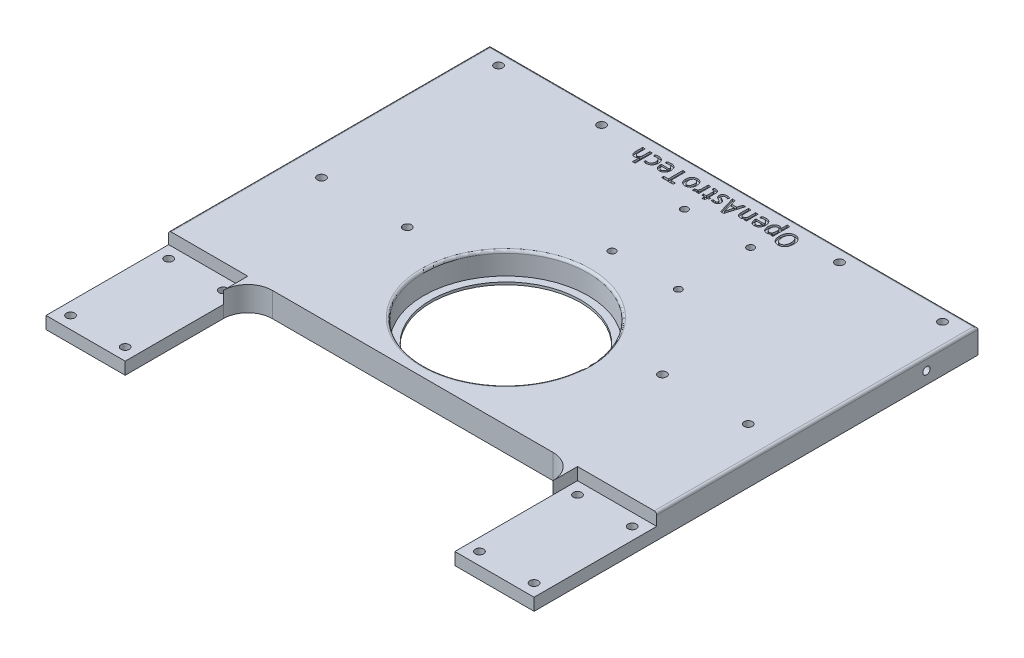
from build123d import *

# Parameters (mm, degrees)
SKIZZE1_W                        = 199
SKIZZE1_H                        = 420
AUFSATZ_LINEAR_AUSTRAGEN1_DEPTH  = 10
SKIZZE5_W                        = 199
SKIZZE5_H                        = 85
SCHNITT_LINEAR_AUSTRAGEN2_DEPTH  = 10
SKIZZE6_R                        = 1.7
SCHNITT_LINEAR_AUSTRAGEN3_DEPTH  = 233.594604409
SCHNITT_LINEAR_AUSTRAGEN4_DEPTH  = 4
SKIZZE16_W                       = 35
SKIZZE16_H                       = 7
SCHNITT_LINEAR_AUSTRAGEN10_DEPTH = 5
SCHNITT_LINEAR_AUSTRAGEN11_DEPTH = 35
SKIZZE20_R                       = 1.7
SCHNITT_LINEAR_AUSTRAGEN12_DEPTH = 233.594604409
SKIZZE21_W                       = 134.422077922
SKIZZE21_H                       = 50
SCHNITT_LINEAR_AUSTRAGEN13_DEPTH = 233.594604409
SCHNITT_LINEAR_AUSTRAGEN14_DEPTH = 233.594604409
AUFSATZ_LINEAR_AUSTRAGEN6_DEPTH  = 10
SKIZZE25_R                       = 1.7
SCHNITT_LINEAR_AUSTRAGEN15_DEPTH = 233.594604409
SCHNITT_LINEAR_AUSTRAGEN16_DEPTH = 290.484023739
SKIZZE27_R                       = 33.5
SCHNITT_LINEAR_AUSTRAGEN17_DEPTH = 161.078886803
SKIZZE28_R                       = 36.006256149
SKIZZE28_R_2                     = 30.5
AUFSATZ_LINEAR_AUSTRAGEN7_DEPTH  = 1
SKIZZE29_R                       = 1.5
SCHNITT_LINEAR_AUSTRAGEN18_DEPTH = 10
SKIZZE30_R                       = 1.5
SCHNITT_LINEAR_AUSTRAGEN19_DEPTH = 10
SKIZZE31_R                       = 2.95
SCHNITT_LINEAR_AUSTRAGEN20_DEPTH = 3.5
SCHNITT_LINEAR_AUSTRAGEN21_DEPTH = 161.078886803
VERRUNDUNG1_R                    = 10
AUFSATZ_LINEAR_AUSTRAGEN8_DEPTH  = 5
VERRUNDUNG2_R                    = 1
SCHNITT_LINEAR_AUSTRAGEN22_DEPTH = 0.8


with BuildPart() as part:
    # Skizze1 → Aufsatz-Linear austragen1 (new body)
    with BuildSketch(Plane(origin=(0, 0, 0), x_dir=(1, 0, 0), z_dir=(0, 1, 0))):
        Rectangle(SKIZZE1_W, SKIZZE1_H)
    extrude(amount=AUFSATZ_LINEAR_AUSTRAGEN1_DEPTH)

    # Skizze5 → Schnitt-Linear austragen2 (cut)
    with BuildSketch(Plane(origin=(0, 10, 0), x_dir=(1, 0, 0), z_dir=(0, 1, 0))):
        Polygon((99.5, -210), (18, -210), (99.5, -56), align=None)
        Polygon((-18, -210), (-99.5, -56), (-99.5, -210), align=None)
        with Locations((0, 167.5)):
            Rectangle(SKIZZE5_W, SKIZZE5_H)
        Polygon((67.211038961, -56), (-67.211038961, -56), (-2.646103896, -178), (2.646103896, -178), align=None)
    extrude(amount=-SCHNITT_LINEAR_AUSTRAGEN2_DEPTH, mode=Mode.SUBTRACT)

    # Skizze6 → Schnitt-Linear austragen3 (cut, through all)
    with BuildSketch(Plane(origin=(0, 10, 0), x_dir=(1, 0, 0), z_dir=(0, 1, 0))):
        with Locations(Location((-11, -205, 0), (0, 0, 270))):
            Circle(SKIZZE6_R)
        with Locations(Location((-11, -188.18, 0), (0, 0, 90))):
            Circle(SKIZZE6_R)
        with Locations(Location((11, -205, 0), (0, 0, 90))):
            Circle(SKIZZE6_R)
        with Locations(Location((11, -188.18, 0), (0, 0, 270))):
            Circle(SKIZZE6_R)
    extrude(amount=-SCHNITT_LINEAR_AUSTRAGEN3_DEPTH, mode=Mode.SUBTRACT)

    # Skizze7 → Schnitt-Linear austragen4 (cut)
    with BuildSketch(Plane.XZ):
        Polygon((-11, 208.406366588), (-8.05, 206.703183294), (-8.05, 203.296816706), (-11, 201.593633412), (-13.95, 203.296816706), (-13.95, 206.703183294), align=None)
        Polygon((11, 208.406366588), (8.05, 206.703183294), (8.05, 203.296816706), (11, 201.593633412), (13.95, 203.296816706), (13.95, 206.703183294), align=None)
        Polygon((-8.05, 186.476816706), (-8.05, 189.883183294), (-11, 191.586366588), (-13.95, 189.883183294), (-13.95, 186.476816706), (-11, 184.773633412), align=None)
        Polygon((8.05, 186.476816706), (8.05, 189.883183294), (11, 191.586366588), (13.95, 189.883183294), (13.95, 186.476816706), (11, 184.773633412), align=None)
    extrude(amount=-SCHNITT_LINEAR_AUSTRAGEN4_DEPTH, mode=Mode.SUBTRACT)

    # Skizze16 → Schnitt-Linear austragen10 (cut)
    with BuildSketch(Plane.XZ):
        with Locations((0, 196.59)):
            Rectangle(SKIZZE16_W, SKIZZE16_H)
    extrude(amount=-SCHNITT_LINEAR_AUSTRAGEN10_DEPTH, mode=Mode.SUBTRACT)

    # Skizze17 → Schnitt-Linear austragen11 (cut)
    with BuildSketch(Plane.ZY.offset(-17.5)):
        Polygon((193.09, 5), (196.59, 8.5), (200.09, 5), align=None)
    extrude(amount=SCHNITT_LINEAR_AUSTRAGEN11_DEPTH, mode=Mode.SUBTRACT)

    # Skizze20 → Schnitt-Linear austragen12 (cut, through all)
    with BuildSketch(Plane(origin=(0, 10, 0), x_dir=(1, 0, 0), z_dir=(0, 1, 0))):
        with Locations(Location((90.5, 119.52, 0), (0, 0, 270))):
            Circle(SKIZZE20_R)
        with Locations(Location((48.5, 119.52, 0), (0, 0, 270))):
            Circle(SKIZZE20_R)
        with Locations(Location((-48.5, 119.52, 0), (0, 0, 90))):
            Circle(SKIZZE20_R)
        with Locations(Location((-90.5, 119.52, 0), (0, 0, 90))):
            Circle(SKIZZE20_R)
        with Locations(Location((87, 43.82, 0), (0, 0, 270))):
            Circle(SKIZZE20_R)
        with Locations(Location((52, 43.82, 0), (0, 0, 270))):
            Circle(SKIZZE20_R)
        with Locations(Location((-87, 43.82, 0), (0, 0, 90))):
            Circle(SKIZZE20_R)
        with Locations(Location((-52, 43.82, 0), (0, 0, 90))):
            Circle(SKIZZE20_R)
    extrude(amount=-SCHNITT_LINEAR_AUSTRAGEN12_DEPTH, mode=Mode.SUBTRACT)

    # Skizze21 → Schnitt-Linear austragen13 (cut, through all)
    with BuildSketch(Plane(origin=(0, 10, 0), x_dir=(1, 0, 0), z_dir=(0, 1, 0))):
        with Locations((0, -31)):
            Rectangle(SKIZZE21_W, SKIZZE21_H)
    extrude(amount=-SCHNITT_LINEAR_AUSTRAGEN13_DEPTH, mode=Mode.SUBTRACT)

    # Skizze22 → Schnitt-Linear austragen14 (cut, through all)
    with BuildSketch(Plane(origin=(0, 10, 0), x_dir=(1, 0, 0), z_dir=(0, 1, 0))):
        with BuildLine():
            Line((-67.211038961, -56), (-2.646103896, -178))
            ThreePointArc((-2.646103896, -178), (-52.825886854, -126.471631215), (-67.211038961, -56))
        make_face()
    schnitt_linear_austragen14 = extrude(amount=-SCHNITT_LINEAR_AUSTRAGEN14_DEPTH, mode=Mode.SUBTRACT)

    # Skizze23 → Aufsatz-Linear austragen6 (add)
    with BuildSketch(Plane(origin=(0, 10, 0), x_dir=(1, 0, 0), z_dir=(0, 1, 0))):
        with BuildLine():
            Line((-99.5, -56), (-18, -210))
            ThreePointArc((-18, -210), (-75.095260266, -141.650251374), (-99.5, -56))
        make_face()
    aufsatz_linear_austragen6 = extrude(amount=-AUFSATZ_LINEAR_AUSTRAGEN6_DEPTH)

    # Spiegeln2: Schnitt-Linear austragen14, Aufsatz-Linear austragen6 across plane
    add(schnitt_linear_austragen14.mirror(Plane(origin=(0, 0, 0), x_dir=(0, 0, 1), z_dir=(1, 0, 0))), mode=Mode.SUBTRACT)
    add(aufsatz_linear_austragen6.mirror(Plane(origin=(0, 0, 0), x_dir=(0, 0, 1), z_dir=(1, 0, 0))))

    # Skizze25 → Schnitt-Linear austragen15 (cut, through all)
    with BuildSketch(Plane(origin=(0, 10, 0), x_dir=(1, 0, 0), z_dir=(0, 1, 0))):
        with Locations(Location((-94.5, -11, 0), (0, 0, 270))):
            Circle(SKIZZE25_R)
        with Locations(Location((-72.211038961, -11, 0), (0, 0, 90))):
            Circle(SKIZZE25_R)
        with Locations(Location((-72.211038961, -51, 0), (0, 0, 270))):
            Circle(SKIZZE25_R)
        with Locations(Location((-94.5, -51, 0), (0, 0, 90))):
            Circle(SKIZZE25_R)
    schnitt_linear_austragen15 = extrude(amount=-SCHNITT_LINEAR_AUSTRAGEN15_DEPTH, mode=Mode.SUBTRACT)

    # Spiegeln3: Schnitt-Linear austragen15 across plane
    add(schnitt_linear_austragen15.mirror(Plane(origin=(0, 0, 0), x_dir=(0, 0, 1), z_dir=(1, 0, 0))), mode=Mode.SUBTRACT)

    # Skizze26 → Schnitt-Linear austragen16 (cut, through all)
    with BuildSketch(Plane.ZY.offset(99.5)):
        Polygon((6, 5), (6, 13.101486595), (200.684563047, 82.546277137), (242.997216492, -41.037631402), (91.241487897, -60.284782055), (56, 0), (56, 5), align=None)
    extrude(amount=-SCHNITT_LINEAR_AUSTRAGEN16_DEPTH, mode=Mode.SUBTRACT)

    # Skizze27 → Schnitt-Linear austragen17 (cut, through all)
    with BuildSketch(Plane(origin=(0, 10, 0), x_dir=(1, 0, 0), z_dir=(0, 1, 0))):
        with Locations(Location((0, 32, 0), (0, 0, 270))):
            Circle(SKIZZE27_R)
    extrude(amount=-SCHNITT_LINEAR_AUSTRAGEN17_DEPTH, mode=Mode.SUBTRACT)

    # Skizze28 → Aufsatz-Linear austragen7 (add)
    with BuildSketch(Plane.XZ):
        with Locations((0, -32)):
            Circle(SKIZZE28_R)
        with Locations(Location((0, -32, 0), (0, 0, 270))):
            Circle(SKIZZE28_R_2, mode=Mode.SUBTRACT)
    extrude(amount=-AUFSATZ_LINEAR_AUSTRAGEN7_DEPTH)

    # Skizze29 → Schnitt-Linear austragen18 (cut)
    with BuildSketch(Plane.ZY.offset(99.5)):
        with Locations((-104, 5)):
            Circle(SKIZZE29_R)
    schnitt_linear_austragen18 = extrude(amount=-SCHNITT_LINEAR_AUSTRAGEN18_DEPTH, mode=Mode.SUBTRACT)

    # Skizze30 → Schnitt-Linear austragen19 (cut)
    with BuildSketch(Plane(origin=(0, 0, -125), x_dir=(-1, 0, 0), z_dir=(0, 0, -1))):
        with Locations((94.5, 5)):
            Circle(SKIZZE30_R)
        with Locations((78.5, 5)):
            Circle(SKIZZE30_R)
    schnitt_linear_austragen19 = extrude(amount=-SCHNITT_LINEAR_AUSTRAGEN19_DEPTH, mode=Mode.SUBTRACT)

    # Spiegeln4: Schnitt-Linear austragen18, Schnitt-Linear austragen19 across plane
    add(schnitt_linear_austragen18.mirror(Plane(origin=(0, 0, 0), x_dir=(0, 0, 1), z_dir=(1, 0, 0))), mode=Mode.SUBTRACT)
    add(schnitt_linear_austragen19.mirror(Plane(origin=(0, 0, 0), x_dir=(0, 0, 1), z_dir=(1, 0, 0))), mode=Mode.SUBTRACT)

    # Skizze31 → Schnitt-Linear austragen20 (cut)
    with BuildSketch(Plane.XZ):
        with Locations(Location((-90.5, -119.52, 0), (0, 0, 270))):
            Circle(SKIZZE31_R)
        with Locations(Location((-48.5, -119.52, 0), (0, 0, 270))):
            Circle(SKIZZE31_R)
        with Locations(Location((-87, -43.82, 0), (0, 0, 270))):
            Circle(SKIZZE31_R)
        with Locations(Location((-52, -43.82, 0), (0, 0, 270))):
            Circle(SKIZZE31_R)
        with Locations(Location((52, -43.82, 0), (0, 0, 90))):
            Circle(SKIZZE31_R)
        with Locations(Location((87, -43.82, 0), (0, 0, 90))):
            Circle(SKIZZE31_R)
        with Locations(Location((48.5, -119.52, 0), (0, 0, 90))):
            Circle(SKIZZE31_R)
        with Locations(Location((90.5, -119.52, 0), (0, 0, 90))):
            Circle(SKIZZE31_R)
    extrude(amount=-SCHNITT_LINEAR_AUSTRAGEN20_DEPTH, mode=Mode.SUBTRACT)

    # Skizze32 → Schnitt-Linear austragen21 (cut, through all)
    with BuildSketch(Plane(origin=(0, 10, 0), x_dir=(1, 0, 0), z_dir=(0, 1, 0))):
        with BuildLine():
            ThreePointArc((26.611267379, 77.141035841), (26.186572211, 78.166340673), (25.161267379, 78.591035841))
            Line((25.161267379, 78.591035841), (25.161267379, 77.141035841))
            Line((25.161267379, 77.141035841), (23.711267379, 77.141035841))
            ThreePointArc((23.711267379, 77.141035841), (25.161267379, 75.691035841), (26.611267379, 77.141035841))
        make_face()
        with BuildLine():
            Line((25.161267379, 77.141035841), (25.161267379, 78.591035841))
            ThreePointArc((25.161267379, 78.591035841), (24.135962546, 78.166340673), (23.711267379, 77.141035841))
            Line((23.711267379, 77.141035841), (25.161267379, 77.141035841))
        make_face()
        with BuildLine():
            ThreePointArc((26.611267379, 77.141035841), (26.186572211, 78.166340673), (25.161267379, 78.591035841))
            Line((25.161267379, 78.591035841), (25.161267379, 77.141035841))
            Line((25.161267379, 77.141035841), (23.711267379, 77.141035841))
            ThreePointArc((23.711267379, 77.141035841), (25.161267379, 75.691035841), (26.611267379, 77.141035841))
        make_face()
        with BuildLine():
            Line((25.161267379, 77.141035841), (25.161267379, 78.591035841))
            ThreePointArc((25.161267379, 78.591035841), (24.135962546, 78.166340673), (23.711267379, 77.141035841))
            Line((23.711267379, 77.141035841), (25.161267379, 77.141035841))
        make_face()
        with BuildLine():
            ThreePointArc((-0.388732621, 77.141035841), (-0.813427789, 78.166340673), (-1.838732621, 78.591035841))
            Line((-1.838732621, 78.591035841), (-1.838732621, 77.141035841))
            Line((-1.838732621, 77.141035841), (-0.388732621, 77.141035841))
        make_face()
        with BuildLine():
            Line((-1.838732621, 77.141035841), (-1.838732621, 78.591035841))
            ThreePointArc((-1.838732621, 78.591035841), (-2.864037454, 76.115731008), (-0.388732621, 77.141035841))
            Line((-0.388732621, 77.141035841), (-1.838732621, 77.141035841))
        make_face()
        with BuildLine():
            ThreePointArc((-0.388732621, 77.141035841), (-0.813427789, 78.166340673), (-1.838732621, 78.591035841))
            Line((-1.838732621, 78.591035841), (-1.838732621, 77.141035841))
            Line((-1.838732621, 77.141035841), (-0.388732621, 77.141035841))
        make_face()
        with BuildLine():
            Line((-1.838732621, 77.141035841), (-1.838732621, 78.591035841))
            ThreePointArc((-1.838732621, 78.591035841), (-2.864037454, 76.115731008), (-0.388732621, 77.141035841))
            Line((-0.388732621, 77.141035841), (-1.838732621, 77.141035841))
        make_face()
        with BuildLine():
            ThreePointArc((-1.838732621, 105.191035841), (-0.813427789, 105.615731008), (-0.388732621, 106.641035841))
            Line((-0.388732621, 106.641035841), (-1.838732621, 106.641035841))
            Line((-1.838732621, 106.641035841), (-1.838732621, 105.191035841))
        make_face()
        with BuildLine():
            Line((-1.838732621, 106.641035841), (-0.388732621, 106.641035841))
            ThreePointArc((-0.388732621, 106.641035841), (-2.864037454, 107.666340673), (-1.838732621, 105.191035841))
            Line((-1.838732621, 105.191035841), (-1.838732621, 106.641035841))
        make_face()
        with BuildLine():
            ThreePointArc((-1.838732621, 105.191035841), (-0.813427789, 105.615731008), (-0.388732621, 106.641035841))
            Line((-0.388732621, 106.641035841), (-1.838732621, 106.641035841))
            Line((-1.838732621, 106.641035841), (-1.838732621, 105.191035841))
        make_face()
        with BuildLine():
            Line((-1.838732621, 106.641035841), (-0.388732621, 106.641035841))
            ThreePointArc((-0.388732621, 106.641035841), (-2.864037454, 107.666340673), (-1.838732621, 105.191035841))
            Line((-1.838732621, 105.191035841), (-1.838732621, 106.641035841))
        make_face()
        with BuildLine():
            ThreePointArc((26.611267379, 106.641035841), (25.161267379, 108.091035841), (23.711267379, 106.641035841))
            Line((23.711267379, 106.641035841), (25.161267379, 106.641035841))
            Line((25.161267379, 106.641035841), (25.161267379, 105.191035841))
            ThreePointArc((25.161267379, 105.191035841), (26.186572211, 105.615731008), (26.611267379, 106.641035841))
        make_face()
        with BuildLine():
            Line((25.161267379, 106.641035841), (23.711267379, 106.641035841))
            ThreePointArc((23.711267379, 106.641035841), (24.135962546, 105.615731008), (25.161267379, 105.191035841))
            Line((25.161267379, 105.191035841), (25.161267379, 106.641035841))
        make_face()
        with BuildLine():
            ThreePointArc((26.611267379, 106.641035841), (25.161267379, 108.091035841), (23.711267379, 106.641035841))
            Line((23.711267379, 106.641035841), (25.161267379, 106.641035841))
            Line((25.161267379, 106.641035841), (25.161267379, 105.191035841))
            ThreePointArc((25.161267379, 105.191035841), (26.186572211, 105.615731008), (26.611267379, 106.641035841))
        make_face()
        with BuildLine():
            Line((25.161267379, 106.641035841), (23.711267379, 106.641035841))
            ThreePointArc((23.711267379, 106.641035841), (24.135962546, 105.615731008), (25.161267379, 105.191035841))
            Line((25.161267379, 105.191035841), (25.161267379, 106.641035841))
        make_face()
    extrude(amount=-SCHNITT_LINEAR_AUSTRAGEN21_DEPTH, mode=Mode.SUBTRACT)

    # Verrundung1
    verrundung1_edges = [part.edges().sort_by_distance(p)[0] for p in [
        (-67.211038961, 2.5, 6),
        (67.211038961, 2.5, 6),
    ]]
    fillet(verrundung1_edges, radius=VERRUNDUNG1_R)

    # Skizze33 → Aufsatz-Linear austragen8 (add)
    with BuildSketch(Plane(origin=(0, 5, 0), x_dir=(1, 0, 0), z_dir=(0, 1, 0))):
        with BuildLine():
            Line((-67.211038961, -16), (-67.211038961, -6))
            Line((-67.211038961, -6), (-57.211038961, -6))
            ThreePointArc((-57.211038961, -6), (-64.282106773, -8.928932188), (-67.211038961, -16))
        make_face()
        with BuildLine():
            Line((67.211038961, -6), (57.211038961, -6))
            ThreePointArc((57.211038961, -6), (64.282106773, -8.928932188), (67.211038961, -16))
            Line((67.211038961, -16), (67.211038961, -6))
        make_face()
    extrude(amount=AUFSATZ_LINEAR_AUSTRAGEN8_DEPTH)

    # Verrundung2
    verrundung2_edges = [part.edges().sort_by_distance(p)[0] for p in [
        (-99.5, 10, -59.5),
        (99.5, 10, -59.5),
        (0, 10, -65.5),
        (0, 10, -125),
    ]]
    fillet(verrundung2_edges, radius=VERRUNDUNG2_R)

    # Skizze34 → Schnitt-Linear austragen22 (cut)
    # profile 1 of 13: a face of its own
    with BuildSketch(Plane(origin=(0, 10, 0), x_dir=(1, 0, 0), z_dir=(0, 1, 0))):
        with BuildLine():
            add(Edge.make_bspline(
                [(29.85070191, 113.090931912), (29.959911613, 113.094940761), (30.173598401, 113.102784734), (30.48499412, 113.152016604), (30.779650983, 113.22706286), (31.056164233, 113.333740855), (31.315421754, 113.468749407), (31.556464113, 113.633691114), (31.779682791, 113.827409855), (31.983756179, 114.048744744), (32.166631051, 114.295628959), (32.327914127, 114.565451122), (32.462509631, 114.858539807), (32.575577092, 115.172234093), (32.662473654, 115.508107676), (32.726835778, 115.86524588), (32.76694588, 116.244457138), (32.774446181, 116.504647174), (32.778293275, 116.638105196)],
                knots=[0, 0, 0, 0, 1.012987315, 1.982076671, 2.918070024, 3.828909042, 4.724975956, 5.623775762, 6.531918119, 7.461037708, 8.410838949, 9.377221151, 10.371713025, 11.397981656, 12.466609933, 13.585978424, 14.761787533, 16, 16, 16, 16], degree=3))
            add(Edge.make_bspline(
                [(32.778293275, 116.638105196), (32.775321146, 116.766398932), (32.769513644, 117.017083332), (32.731464831, 117.382799439), (32.671661892, 117.728520707), (32.587580559, 118.053430124), (32.482227657, 118.358319093), (32.352914557, 118.642430913), (32.199816042, 118.906122032), (32.024709744, 119.148223571), (31.830202269, 119.367757328), (31.614608781, 119.558508991), (31.380775114, 119.721088981), (31.128249789, 119.855106236), (30.856880414, 119.959722692), (30.567286493, 120.035460723), (30.259802799, 120.084207034), (30.048457931, 120.092586281), (29.940295523, 120.096874626)],
                knots=[0, 0, 0, 0, 1.222503048, 2.388756074, 3.500169846, 4.563104703, 5.583468788, 6.570443324, 7.533038822, 8.484279774, 9.413372322, 10.322376827, 11.220780875, 12.121240343, 13.040147159, 13.98580634, 14.969172806, 16, 16, 16, 16], degree=3))
            add(Edge.make_bspline(
                [(29.940295523, 120.096874626), (29.835619445, 120.094676443), (29.630144854, 120.090361507), (29.329534393, 120.048140992), (29.044126508, 119.978544581), (28.774000206, 119.881458737), (28.518933666, 119.756652337), (28.278784135, 119.603739815), (28.055027143, 119.421008012), (27.844672014, 119.213791644), (27.656220129, 118.976193705), (27.489236714, 118.711252378), (27.350887969, 118.415696615), (27.234761011, 118.093418144), (27.143332961, 117.74261854), (27.07752364, 117.364041486), (27.034271005, 116.95697697), (27.02636499, 116.676074984), (27.022281463, 116.530986591)],
                knots=[0, 0, 0, 0, 0.964497264, 1.893266228, 2.791633031, 3.66849831, 4.534017508, 5.404221222, 6.286807308, 7.19257516, 8.120979983, 9.076063375, 10.07298676, 11.122987012, 12.230146749, 13.410274263, 14.662383454, 16, 16, 16, 16], degree=3))
            add(Edge.make_bspline(
                [(27.022281463, 116.530986591), (27.024421524, 116.407438746), (27.028606181, 116.165854442), (27.063913892, 115.812538955), (27.122191425, 115.477618553), (27.200200108, 115.15958055), (27.302067792, 114.85926234), (27.427545846, 114.576815475), (27.57567298, 114.312282941), (27.74317652, 114.065480845), (27.934682277, 113.84262824), (28.146859965, 113.646681424), (28.379979279, 113.479099168), (28.635261514, 113.344271355), (28.909492062, 113.234050895), (29.205331829, 113.156945927), (29.520856407, 113.105297548), (29.738327366, 113.095377361), (29.85070191, 113.090931912)],
                knots=[0, 0, 0, 0, 1.181997023, 2.311265979, 3.393394717, 4.432710499, 5.441572568, 6.423779709, 7.385757606, 8.339154063, 9.273212536, 10.190881701, 11.096730823, 12.012033381, 12.946898792, 13.918455472, 14.931549697, 16, 16, 16, 16], degree=3))
        make_face()
        with BuildLine():
            add(Edge.make_bspline(
                [(29.886853431, 113.902712781), (29.811948825, 113.90849574), (29.665888764, 113.919772207), (29.454784173, 113.965638345), (29.258439386, 114.034634864), (29.078726615, 114.130740385), (28.913049212, 114.247728191), (28.76198569, 114.38841423), (28.627315967, 114.55385683), (28.510396113, 114.741271882), (28.407073457, 114.94271623), (28.31720149, 115.153543349), (28.238505992, 115.370639684), (28.177639287, 115.596293214), (28.1275986, 115.828288316), (28.095259166, 116.068242239), (28.073409113, 116.315050343), (28.071304092, 116.482325014), (28.070236976, 116.567122988)],
                knots=[0, 0, 0, 0, 1.004441371, 1.958608082, 2.88184463, 3.780632764, 4.676761865, 5.589219383, 6.534241407, 7.522869299, 8.539936667, 9.561215444, 10.588238561, 11.627388882, 12.686505249, 13.762033373, 14.865488509, 16, 16, 16, 16], degree=3))
            add(Edge.make_bspline(
                [(28.070236976, 116.567122988), (28.071893818, 116.659650783), (28.075142307, 116.841065519), (28.095645827, 117.107897123), (28.131219527, 117.363661836), (28.183635441, 117.608198644), (28.247510213, 117.84216724), (28.325927076, 118.065188098), (28.42112079, 118.276095089), (28.527705051, 118.475445366), (28.649803199, 118.657957644), (28.786439566, 118.81895877), (28.938221544, 118.956610637), (29.103792046, 119.070786311), (29.284199066, 119.160908998), (29.478459813, 119.226135836), (29.686213639, 119.271785137), (29.830352002, 119.280588467), (29.904159126, 119.285096278)],
                knots=[0, 0, 0, 0, 1.215168902, 2.3825224, 3.512302654, 4.603757503, 5.664662392, 6.695722199, 7.704767967, 8.700807624, 9.661364617, 10.583018582, 11.467001179, 12.34458741, 13.216279754, 14.10603896, 15.030183138, 16, 16, 16, 16], degree=3))
            add(Edge.make_bspline(
                [(29.904159126, 119.285096278), (29.97708293, 119.280000954), (30.119434233, 119.270054598), (30.325056433, 119.225373971), (30.516463719, 119.157659684), (30.695564845, 119.068312274), (30.860359686, 118.953655717), (31.010697031, 118.815509162), (31.147747809, 118.65479444), (31.268191351, 118.471937779), (31.375817945, 118.273662199), (31.469994117, 118.064311097), (31.550219911, 117.845235996), (31.616308515, 117.616770831), (31.665676677, 117.378394832), (31.703786032, 117.131686029), (31.725697464, 116.875109349), (31.728772363, 116.70095406), (31.730337761, 116.612293484)],
                knots=[0, 0, 0, 0, 0.974094497, 1.901486386, 2.796224591, 3.676437371, 4.563042432, 5.464727423, 6.392722701, 7.373084354, 8.37967889, 9.39929017, 10.432248303, 11.489232847, 12.568520497, 13.677080387, 14.817426717, 16, 16, 16, 16], degree=3))
            add(Edge.make_bspline(
                [(31.730337761, 116.612293484), (31.729046937, 116.525798237), (31.726494108, 116.35473889), (31.707777075, 116.101999618), (31.671771217, 115.857078987), (31.625545207, 115.619463386), (31.561015772, 115.390629359), (31.485521173, 115.168436762), (31.393288182, 114.955066303), (31.29041418, 114.749995149), (31.17226193, 114.560510707), (31.035561719, 114.393146648), (30.882642568, 114.250445959), (30.713949768, 114.131054068), (30.529048865, 114.036592632), (30.328721813, 113.965379975), (30.112684402, 113.918031747), (29.962903831, 113.907476712), (29.886090927, 113.902063707)],
                knots=[0, 0, 0, 0, 1.136615237, 2.247853704, 3.32712805, 4.38811145, 5.426335915, 6.448929369, 7.469567769, 8.478317094, 9.461655943, 10.397556452, 11.309504531, 12.201935297, 13.104531622, 14.028957108, 14.989177776, 16, 16, 16, 16], degree=3))
            Line((29.886090927, 113.902063707), (29.886853431, 113.902712781))
        make_face(mode=Mode.SUBTRACT)
    # profile 2 of 13: a face of its own
    with BuildSketch(Plane(origin=(0, 10, 0), x_dir=(1, 0, 0), z_dir=(0, 1, 0))):
        with BuildLine():
            Line((24.817961244, 115.829226885), (24.872165839, 115.095396631))
            Line((24.872165839, 115.095396631), (25.793191503, 115.095396631))
            add(Edge.make_bspline(
                [(25.793191503, 115.095396631), (25.790144741, 115.148884854), (25.783841774, 115.259538265), (25.777787661, 115.430953847), (25.772999215, 115.612519407), (25.767394898, 115.804366193), (25.763621594, 116.006137492), (25.761466156, 116.218665646), (25.758393683, 116.441068602), (25.757806813, 116.592933563), (25.757507567, 116.670369836)],
                knots=[0, 0, 0, 0, 0.816080132, 1.688260417, 2.612621697, 3.582837222, 4.611864457, 5.686655616, 6.820420674, 8, 8, 8, 8], degree=3))
            Line((25.757507567, 116.670369836), (25.757508827, 121.988702982))
            Line((25.757508827, 121.988702982), (24.709552053, 121.988702982))
            Line((24.709552053, 121.988702982), (24.709552053, 119.426925839))
            Line((24.709552053, 119.426925839), (24.691747265, 119.426925839))
            add(Edge.make_bspline(
                [(24.691747265, 119.426925839), (24.659504168, 119.475804893), (24.594691339, 119.574058166), (24.47119197, 119.702615598), (24.33052588, 119.818067523), (24.170193155, 119.914908922), (23.995057427, 119.996099393), (23.804404343, 120.051624545), (23.601996633, 120.089597198), (23.462168407, 120.094410248), (23.390573561, 120.096874626)],
                knots=[0, 0, 0, 0, 0.917555489, 1.844406173, 2.785224624, 3.767404775, 4.776790174, 5.806572874, 6.876921489, 8, 8, 8, 8], degree=3))
            add(Edge.make_bspline(
                [(23.390573561, 120.096874626), (23.324653475, 120.095773957), (23.193890548, 120.093590607), (23.000773749, 120.064290351), (22.813637928, 120.014787611), (22.63206235, 119.94585428), (22.45566722, 119.857916109), (22.285743104, 119.748711629), (22.1231915, 119.618107153), (21.965301151, 119.471075345), (21.819665279, 119.301155404), (21.691692623, 119.107975338), (21.583052996, 118.891497741), (21.493331567, 118.652955118), (21.420865103, 118.392579578), (21.369558378, 118.109520356), (21.332220318, 117.804853631), (21.324472077, 117.593685167), (21.320474246, 117.484729355)],
                knots=[0, 0, 0, 0, 0.846490182, 1.679147299, 2.502484195, 3.330060495, 4.17066308, 5.030977055, 5.920271087, 6.847142536, 7.799964117, 8.788939239, 9.817453113, 10.905797346, 12.05931981, 13.285633072, 14.599478126, 16, 16, 16, 16], degree=3))
            add(Edge.make_bspline(
                [(21.320474246, 117.484729355), (21.323533875, 117.390434117), (21.329484865, 117.207029542), (21.358842788, 116.939856218), (21.400722504, 116.687764308), (21.464468876, 116.452041735), (21.538590487, 116.23013031), (21.634068321, 116.025502323), (21.743760628, 115.835953417), (21.868795484, 115.663008678), (22.007013452, 115.508052054), (22.155080649, 115.371725673), (22.314352874, 115.256928482), (22.482639523, 115.162871838), (22.659955491, 115.086272552), (22.847825341, 115.032880079), (23.045166036, 114.998199734), (23.180062398, 114.992780914), (23.248609144, 114.990027374)],
                knots=[0, 0, 0, 0, 1.284748414, 2.49884027, 3.658844163, 4.761893676, 5.821980921, 6.841963681, 7.832011751, 8.801448359, 9.743649362, 10.656243259, 11.537788843, 12.411527703, 13.277984211, 14.162660369, 15.066367302, 16, 16, 16, 16], degree=3))
            add(Edge.make_bspline(
                [(23.248609144, 114.990027374), (23.332250648, 114.993191702), (23.494987842, 114.999348379), (23.730753165, 115.04168367), (23.950815609, 115.108535308), (24.154754837, 115.202033081), (24.342373702, 115.320419308), (24.513499814, 115.464391566), (24.668170841, 115.634427629), (24.755400278, 115.763216963), (24.799893045, 115.82890802)],
                knots=[0, 0, 0, 0, 1.087119714, 2.115155793, 3.104108699, 4.070148142, 5.022884304, 5.979617794, 6.969471783, 8, 8, 8, 8], degree=3))
            Line((24.799893045, 115.82890802), (24.817961244, 115.829226885))
        make_face()
        with BuildLine():
            add(Edge.make_bspline(
                [(24.709552053, 117.109748698), (24.707751143, 117.063895082), (24.704227908, 116.974188764), (24.685851832, 116.843133844), (24.657187318, 116.71851914), (24.619603241, 116.599433763), (24.573914701, 116.485635402), (24.516160741, 116.378721776), (24.448615827, 116.278083986), (24.373343659, 116.182884611), (24.290042782, 116.097143912), (24.201629816, 116.021921558), (24.109870106, 115.956298147), (24.012045507, 115.903466665), (23.909843961, 115.860114596), (23.802180778, 115.829923339), (23.690813414, 115.808137002), (23.614807618, 115.803930422), (23.576417889, 115.801805722)],
                knots=[0, 0, 0, 0, 1.14962799, 2.249089649, 3.311058881, 4.351180817, 5.376384794, 6.379810015, 7.390623649, 8.411110361, 9.417659183, 10.381366364, 11.317721371, 12.239371103, 13.162533389, 14.094158043, 15.037379231, 16, 16, 16, 16], degree=3))
            add(Edge.make_bspline(
                [(23.576417889, 115.801805722), (23.528527475, 115.804488128), (23.434589281, 115.809749732), (23.299076901, 115.837619198), (23.172026979, 115.878488717), (23.055017422, 115.936523453), (22.945853132, 116.007081918), (22.847195306, 116.094174572), (22.755562149, 116.193477467), (22.677337946, 116.309515947), (22.604759001, 116.433703725), (22.543210956, 116.567599787), (22.489770937, 116.708393311), (22.447855267, 116.857154394), (22.414143732, 117.01273385), (22.389519156, 117.175625633), (22.375521598, 117.345959714), (22.373387023, 117.461903987), (22.372301517, 117.520865752)],
                knots=[0, 0, 0, 0, 0.981281094, 1.924806366, 2.824826389, 3.707556406, 4.592263226, 5.479205099, 6.396146844, 7.351895143, 8.338817304, 9.34011022, 10.366256886, 11.420469175, 12.502377923, 13.625172906, 14.792316403, 16, 16, 16, 16], degree=3))
            add(Edge.make_bspline(
                [(22.372301517, 117.520865752), (22.373204163, 117.584571631), (22.374963482, 117.708738715), (22.391206862, 117.890097311), (22.415242835, 118.062597785), (22.449360137, 118.225861753), (22.495383212, 118.379539848), (22.549314331, 118.524161213), (22.612051812, 118.660334046), (22.68588169, 118.785412887), (22.767729162, 118.900077492), (22.861376777, 118.999338778), (22.962290013, 119.085865163), (23.073072266, 119.156337513), (23.193452975, 119.210311863), (23.321314287, 119.25199797), (23.458785032, 119.278514413), (23.553497742, 119.282860247), (23.602229601, 119.285096278)],
                knots=[0, 0, 0, 0, 1.269292117, 2.473936553, 3.625744077, 4.738870092, 5.794066467, 6.819554918, 7.812933128, 8.777481147, 9.710342625, 10.614110635, 11.490085324, 12.353424998, 13.220460075, 14.11244037, 15.02880731, 16, 16, 16, 16], degree=3))
            add(Edge.make_bspline(
                [(23.602229601, 119.285096278), (23.63539051, 119.284433309), (23.701112143, 119.283119368), (23.798973485, 119.27006651), (23.894670928, 119.246223005), (23.989329722, 119.214516808), (24.081175992, 119.170806583), (24.172095825, 119.119672403), (24.259673888, 119.056577801), (24.346266973, 118.986371005), (24.427762196, 118.906212976), (24.498534297, 118.812515286), (24.558029323, 118.707825701), (24.611415971, 118.593272693), (24.649749006, 118.466053748), (24.681246148, 118.328625246), (24.701826427, 118.179620618), (24.706919283, 118.076310226), (24.709552053, 118.022903553)],
                knots=[0, 0, 0, 0, 0.847190485, 1.679047567, 2.516335765, 3.364666864, 4.225444966, 5.111820278, 6.026912602, 6.979920651, 7.959447896, 8.940146714, 9.969728307, 11.03246919, 12.162514152, 13.35738975, 14.633893301, 16, 16, 16, 16], degree=3))
            Line((24.709552053, 118.022903553), (24.709552053, 117.109748698))
        make_face(mode=Mode.SUBTRACT)
    # profile 3 of 13: a face of its own
    with BuildSketch(Plane(origin=(0, 10, 0), x_dir=(1, 0, 0), z_dir=(0, 1, 0))):
        with BuildLine():
            add(Edge.make_bspline(
                [(16.613363201, 119.057833479), (16.653786285, 119.073711615), (16.737266115, 119.106502387), (16.86819858, 119.150015376), (17.00778448, 119.188662328), (17.156336079, 119.222246598), (17.316221164, 119.251947593), (17.49016476, 119.269418902), (17.677780458, 119.28362326), (17.80746802, 119.284593803), (17.874610672, 119.285096278)],
                knots=[0, 0, 0, 0, 0.807825304, 1.668282384, 2.565327444, 3.501091415, 4.501076391, 5.588123788, 6.751308416, 8, 8, 8, 8], degree=3))
            add(Edge.make_bspline(
                [(17.874610672, 119.285096278), (17.925402919, 119.284532017), (18.025477625, 119.283420268), (18.17273612, 119.269289386), (18.314363435, 119.24342352), (18.450471377, 119.205985801), (18.580730541, 119.15675868), (18.705801038, 119.097206474), (18.824274602, 119.025868533), (18.937403401, 118.944944273), (19.041886308, 118.850460898), (19.133351428, 118.740181033), (19.212494431, 118.615967763), (19.280596162, 118.478388855), (19.332226443, 118.324772603), (19.37361236, 118.158233754), (19.401950763, 117.977235451), (19.410919427, 117.851778661), (19.415569888, 117.786726387)],
                knots=[0, 0, 0, 0, 1.003821022, 1.977803686, 2.920237442, 3.846610977, 4.764317279, 5.669606295, 6.581144933, 7.494625336, 8.415635581, 9.357493617, 10.317603466, 11.321676618, 12.384022293, 13.514314644, 14.711114122, 16, 16, 16, 16], degree=3))
            Line((19.415569888, 117.786726387), (16.221020135, 117.786727648))
            add(Edge.make_bspline(
                [(16.221020135, 117.786727648), (16.213118033, 117.727873173), (16.19598574, 117.600272666), (16.194869562, 117.471506122), (16.194268211, 117.402131876)],
                knots=[0, 0, 0, 0, 0.922480256, 2, 2, 2, 2], degree=3))
            add(Edge.make_bspline(
                [(16.194268211, 117.402131876), (16.194992014, 117.323802032), (16.196418128, 117.169468394), (16.215640078, 116.94250941), (16.250912831, 116.724403218), (16.299420572, 116.51545336), (16.363081542, 116.315151287), (16.441198087, 116.123864749), (16.536990579, 115.942584836), (16.643402488, 115.769403136), (16.768638197, 115.610920308), (16.912859892, 115.471608191), (17.075810327, 115.353180441), (17.257505871, 115.255798547), (17.457508882, 115.178684925), (17.675525464, 115.120814184), (17.912088062, 115.082932217), (18.076227503, 115.075287914), (18.161120677, 115.071334268)],
                knots=[0, 0, 0, 0, 1.088258919, 2.144201347, 3.161392954, 4.156115076, 5.122205167, 6.079152244, 7.02301405, 7.968445822, 8.900189722, 9.821849371, 10.746141896, 11.690325474, 12.678342742, 13.718051002, 14.819772421, 16, 16, 16, 16], degree=3))
            add(Edge.make_bspline(
                [(18.161120677, 115.071334268), (18.24857851, 115.075366641), (18.418672151, 115.08320906), (18.666199481, 115.120705926), (18.897493959, 115.18130741), (19.113495278, 115.262893977), (19.313968961, 115.365208569), (19.498533238, 115.489610737), (19.666343467, 115.637401704), (19.817819863, 115.805171828), (19.953251418, 115.989355979), (20.06964292, 116.188451023), (20.16882172, 116.399400243), (20.252538005, 116.622123764), (20.314798187, 116.858470961), (20.361404505, 117.106838697), (20.390173259, 117.367909955), (20.394307919, 117.54617449), (20.396414951, 117.637018457)],
                knots=[0, 0, 0, 0, 1.097073915, 2.133660216, 3.131777163, 4.089365149, 5.022835012, 5.947271411, 6.872179662, 7.819061179, 8.775874276, 9.733219228, 10.705472601, 11.695249203, 12.711774485, 13.765324905, 14.861205065, 16, 16, 16, 16], degree=3))
            add(Edge.make_bspline(
                [(20.396414951, 117.637018457), (20.394399081, 117.727006545), (20.390452432, 117.903184339), (20.360584404, 118.160579866), (20.310730674, 118.404033689), (20.246807312, 118.634930664), (20.158599825, 118.850262417), (20.054696868, 119.05300211), (19.929282064, 119.240706015), (19.788283861, 119.415601411), (19.627390594, 119.57217022), (19.449792932, 119.709984975), (19.25469486, 119.826652794), (19.042902306, 119.9224858), (18.813798732, 119.997167402), (18.568392909, 120.052136488), (18.305806135, 120.087689749), (18.125100141, 120.09375294), (18.032062117, 120.096874626)],
                knots=[0, 0, 0, 0, 1.11926085, 2.191277874, 3.21768626, 4.208561963, 5.166521665, 6.107165599, 7.03777016, 7.969666288, 8.896817873, 9.823784114, 10.759896121, 11.717855824, 12.70952599, 13.752004883, 14.842600514, 16, 16, 16, 16], degree=3))
            add(Edge.make_bspline(
                [(18.032062117, 120.096874626), (17.94770152, 120.095688957), (17.783942182, 120.093387358), (17.545897263, 120.074122853), (17.322160085, 120.048158882), (17.113401125, 120.010363181), (16.920876186, 119.965810884), (16.745329714, 119.91484612), (16.586731805, 119.861305168), (16.489509787, 119.817137751), (16.443351233, 119.796168179)],
                knots=[0, 0, 0, 0, 1.242803849, 2.412509434, 3.517166938, 4.560371965, 5.53672833, 6.427455742, 7.253395773, 8, 8, 8, 8], degree=3))
            Line((16.443351233, 119.796168179), (16.613363201, 119.057833479))
        make_face()
        with BuildLine():
            add(Edge.make_bspline(
                [(19.4062018, 117.136271241), (19.396578602, 117.055081644), (19.377367779, 116.893002568), (19.314306425, 116.65353295), (19.218278548, 116.421578408), (19.118862239, 116.233914171), (19.022041057, 116.093808428), (18.938235814, 116.000625543), (18.844246312, 115.921043696), (18.740821114, 115.854657698), (18.628464933, 115.799956149), (18.50545037, 115.760255166), (18.373425131, 115.73277412), (18.281705709, 115.725512313), (18.234684057, 115.721789414)],
                knots=[0, 0, 0, 0, 1.454956346, 2.904534441, 4.392799258, 5.918481753, 6.677368679, 7.420583398, 8.143618746, 8.864091933, 9.604298954, 10.362682884, 11.1605992, 12, 12, 12, 12], degree=3))
            add(Edge.make_bspline(
                [(18.234684057, 115.721789414), (18.185975888, 115.725637682), (18.09183232, 115.733075648), (17.956384665, 115.758317613), (17.833519123, 115.798557665), (17.721195362, 115.850713249), (17.620847778, 115.916388573), (17.531108587, 115.994940435), (17.454934352, 116.087437694), (17.36988854, 116.226275229), (17.286856283, 116.413133322), (17.216568333, 116.647372512), (17.176119913, 116.889624935), (17.175450982, 117.053525991), (17.175113273, 117.136271241)],
                knots=[0, 0, 0, 0, 0.882754082, 1.706194681, 2.48317328, 3.213589876, 3.938189638, 4.643296314, 5.361064229, 6.094578012, 7.580379611, 9.041543834, 10.506426984, 12, 12, 12, 12], degree=3))
            Line((17.175113273, 117.136271241), (19.4062018, 117.136271241))
        make_face(mode=Mode.SUBTRACT)
    # profile 4 of 13: a face of its own
    with BuildSketch(Plane(origin=(0, 10, 0), x_dir=(1, 0, 0), z_dir=(0, 1, 0))):
        with BuildLine():
            add(Edge.make_bspline(
                [(10.915774334, 116.96214049), (10.919235746, 116.873393416), (10.925923923, 116.701915378), (10.956139682, 116.455717733), (10.998686243, 116.229582467), (11.058681015, 116.025237348), (11.129355952, 115.840155348), (11.218570869, 115.677448632), (11.319547307, 115.533146432), (11.439228723, 115.413898955), (11.564702136, 115.310681736), (11.693948991, 115.221569692), (11.825862644, 115.145347156), (11.962385677, 115.086752126), (12.100481623, 115.038850883), (12.242298478, 115.009003123), (12.386464923, 114.98904553), (12.483765879, 114.989698034), (12.53287684, 114.990027374)],
                knots=[0, 0, 0, 0, 1.480221054, 2.860098845, 4.131747366, 5.312082711, 6.406943855, 7.427608032, 8.398995705, 9.332270553, 10.234118419, 11.105561393, 11.947182291, 12.769416024, 13.579166109, 14.379714916, 15.182189356, 16, 16, 16, 16], degree=3))
            add(Edge.make_bspline(
                [(12.53287684, 114.990027374), (12.619577228, 114.994773622), (12.786978609, 115.003937692), (13.026775816, 115.052042127), (13.244887927, 115.127859932), (13.438934672, 115.232467217), (13.609680897, 115.354796813), (13.757259722, 115.488094465), (13.883465308, 115.629306357), (13.947912119, 115.733673861), (13.979623307, 115.785028109)],
                knots=[0, 0, 0, 0, 1.205440727, 2.327468731, 3.386321203, 4.402633352, 5.379752798, 6.298254991, 7.162652823, 8, 8, 8, 8], degree=3))
            Line((13.979623307, 115.785028109), (14.006725605, 115.785542327))
            Line((14.006725605, 115.785542327), (14.0609302, 115.092182771))
            Line((14.0609302, 115.092182771), (14.972921764, 115.092182771))
            add(Edge.make_bspline(
                [(14.972921764, 115.092182771), (14.968229555, 115.192345727), (14.958602038, 115.397860994), (14.948155231, 115.658923683), (14.943832603, 115.878812943), (14.93899267, 116.055166093), (14.938703204, 116.241898363), (14.937736056, 116.36966445), (14.937237828, 116.435483256)],
                knots=[0, 0, 0, 0, 1.343028842, 2.755638842, 3.499120882, 4.288686139, 5.118415249, 6, 6, 6, 6], degree=3))
            Line((14.937237828, 116.435483256), (14.937239089, 119.968405903))
            Line((14.937239089, 119.968405903), (13.889282314, 119.968405903))
            Line((13.889282314, 119.968405903), (13.889282314, 117.006743834))
            add(Edge.make_bspline(
                [(13.889282314, 117.006743834), (13.886994715, 116.958658914), (13.882560996, 116.865462951), (13.864207244, 116.730577228), (13.837486439, 116.604851671), (13.801049363, 116.487852766), (13.756606913, 116.379320659), (13.701416482, 116.280176284), (13.638490515, 116.189180906), (13.565727414, 116.108658657), (13.488835926, 116.03597322), (13.407054243, 115.974652602), (13.324500536, 115.920670793), (13.238200524, 115.877725817), (13.149407899, 115.84454341), (13.058429303, 115.819307229), (12.96481103, 115.805080071), (12.90159928, 115.802903455), (12.869719684, 115.801805722)],
                knots=[0, 0, 0, 0, 1.313874615, 2.54649082, 3.712260852, 4.819391942, 5.888289695, 6.908243364, 7.911901815, 8.901996691, 9.866038371, 10.796358496, 11.689141585, 12.555891312, 13.422004075, 14.273983139, 15.129517517, 16, 16, 16, 16], degree=3))
            add(Edge.make_bspline(
                [(12.869719684, 115.801805722), (12.829182502, 115.803882226), (12.750602998, 115.807907437), (12.638133448, 115.829052082), (12.534346119, 115.859867499), (12.440128738, 115.902375483), (12.355117504, 115.955482236), (12.280400273, 116.020316473), (12.213727965, 116.095152002), (12.140442876, 116.213172526), (12.065880839, 116.377954042), (12.002969309, 116.595192756), (11.966357053, 116.833878869), (11.964627183, 116.999766618), (11.963728587, 117.085938402)],
                knots=[0, 0, 0, 0, 0.82045112, 1.590407583, 2.3090629, 3.006369623, 3.675284288, 4.32954105, 5.001788588, 5.694735739, 7.131861874, 8.646725831, 10.258113576, 12, 12, 12, 12], degree=3))
            Line((11.963728587, 117.085938402), (11.963729848, 119.968405903))
            Line((11.963729848, 119.968405903), (10.915774334, 119.968405903))
            Line((10.915774334, 119.968405903), (10.915774334, 116.96214049))
        make_face()
    # profile 5 of 13: a face of its own
    with BuildSketch(Plane(origin=(0, 10, 0), x_dir=(1, 0, 0), z_dir=(0, 1, 0))):
        Polygon((6.387374106, 113.174685121), (7.653930119, 113.174685121), (9.74134143, 120.039735964), (8.679662101, 120.039735964), (8.090981138, 118.032585466), (6.003839538, 118.032585466), (5.388400349, 120.039735964), (4.300232507, 120.039735964), align=None)
        with BuildLine():
            Line((7.930431784, 117.220804598), (7.386347863, 115.414577105))
            add(Edge.make_bspline(
                [(7.386347863, 115.414577105), (7.357403775, 115.304576264), (7.298402392, 115.080343875), (7.217735912, 114.740068402), (7.140756914, 114.400242644), (7.089635781, 114.175663808), (7.064665619, 114.065968079)],
                knots=[0, 0, 0, 0, 0.984388492, 2.00663722, 3.026340208, 4, 4, 4, 4], degree=3))
            Line((7.064665619, 114.065968079), (7.047410338, 114.066752009))
            add(Edge.make_bspline(
                [(7.047410338, 114.066752009), (7.021894492, 114.175792732), (6.969751989, 114.398621171), (6.887906233, 114.73664914), (6.801332255, 115.079739363), (6.73933958, 115.308459152), (6.708463991, 115.422373553)],
                knots=[0, 0, 0, 0, 0.961633894, 1.965131681, 2.986529303, 4, 4, 4, 4], degree=3))
            Line((6.708463991, 115.422373553), (6.173308301, 117.220804598))
            Line((6.173308301, 117.220804598), (7.930431784, 117.220804598))
        make_face(mode=Mode.SUBTRACT)
    # profile 6 of 13: a face of its own
    with BuildSketch(Plane(origin=(0, 10, 0), x_dir=(1, 0, 0), z_dir=(0, 1, 0))):
        with BuildLine():
            add(Edge.make_bspline(
                [(0.510715225, 115.264693988), (0.545360246, 115.245614186), (0.617688827, 115.20578119), (0.736970499, 115.157081528), (0.867202664, 115.110184167), (1.009024518, 115.069330204), (1.161331789, 115.034075379), (1.323455195, 115.008583315), (1.494636425, 114.993121829), (1.611479197, 114.990221763), (1.671308363, 114.988736789)],
                knots=[0, 0, 0, 0, 0.787012033, 1.643048903, 2.561615611, 3.543028024, 4.580035077, 5.672964899, 6.808445181, 8, 8, 8, 8], degree=3))
            add(Edge.make_bspline(
                [(1.671308363, 114.988736789), (1.735910752, 114.990710107), (1.861612673, 114.994549746), (2.044400666, 115.017429008), (2.216859641, 115.050081104), (2.378630788, 115.09694377), (2.530053035, 115.154625785), (2.670794664, 115.2246865), (2.800780909, 115.307562281), (2.918718995, 115.403421478), (3.026337611, 115.506868609), (3.118071617, 115.620468119), (3.197583265, 115.739906773), (3.264338824, 115.866571672), (3.313922462, 116.001930841), (3.351772989, 116.143055615), (3.375574425, 116.291445648), (3.379388482, 116.392806334), (3.381334293, 116.444517355)],
                knots=[0, 0, 0, 0, 1.232557026, 2.39828261, 3.510625914, 4.578343488, 5.607275675, 6.59838632, 7.572907593, 8.542021365, 9.493950285, 10.41567434, 11.321732644, 12.228534229, 13.140226264, 14.066034573, 15.013351922, 16, 16, 16, 16], degree=3))
            add(Edge.make_bspline(
                [(3.381334293, 116.444517355), (3.380833294, 116.480706703), (3.379845065, 116.552090803), (3.36459339, 116.657856337), (3.341298725, 116.76140355), (3.309732877, 116.863406893), (3.265917061, 116.962153796), (3.214495296, 117.058988989), (3.153549742, 117.153797236), (3.082125176, 117.24561366), (3.000410265, 117.334772792), (2.908289288, 117.421684799), (2.805105673, 117.505243276), (2.690613265, 117.585478681), (2.565698868, 117.662705745), (2.42928242, 117.736261631), (2.282359159, 117.807162752), (2.179559995, 117.850823561), (2.126885082, 117.873195623)],
                knots=[0, 0, 0, 0, 0.856570748, 1.689600267, 2.525243707, 3.369664766, 4.214024329, 5.08024009, 5.965019938, 6.880262619, 7.832432144, 8.827272986, 9.877713891, 10.974725943, 12.137055048, 13.354585976, 14.644473867, 16, 16, 16, 16], degree=3))
            add(Edge.make_bspline(
                [(2.126885082, 117.873195623), (2.057609191, 117.902753859), (1.927782194, 117.95814769), (1.752595433, 118.050231478), (1.610524426, 118.14480599), (1.496234546, 118.239353187), (1.411599056, 118.343079702), (1.353205326, 118.456796005), (1.320049994, 118.582431595), (1.3176387, 118.669719794), (1.31639732, 118.714657439)],
                knots=[0, 0, 0, 0, 1.442762864, 2.70382045, 3.785089876, 4.70858488, 5.534986822, 6.331202735, 7.140871051, 8, 8, 8, 8], degree=3))
            add(Edge.make_bspline(
                [(1.31639732, 118.714657439), (1.318641178, 118.761000125), (1.322985077, 118.850715206), (1.363610019, 118.978146609), (1.428963086, 119.091577125), (1.522211845, 119.189120266), (1.641899462, 119.269093669), (1.789674886, 119.324659416), (1.963103933, 119.359547784), (2.087548106, 119.364017072), (2.15398738, 119.366403172)],
                knots=[0, 0, 0, 0, 0.926104259, 1.792850767, 2.650120586, 3.527934928, 4.472027328, 5.509011128, 6.67009046, 8, 8, 8, 8], degree=3))
            add(Edge.make_bspline(
                [(2.15398738, 119.366403172), (2.207381277, 119.363630139), (2.314073887, 119.358089018), (2.47263766, 119.337839612), (2.628262142, 119.303755182), (2.778874048, 119.258744517), (2.921159602, 119.206487421), (3.051382728, 119.15079749), (3.16922619, 119.094942443), (3.240124892, 119.051661864), (3.274215688, 119.030850913)],
                knots=[0, 0, 0, 0, 1.085025068, 2.168115887, 3.240274869, 4.315026485, 5.356485687, 6.315024378, 7.189799554, 8, 8, 8, 8], degree=3))
            Line((3.274215688, 119.030850913), (3.506224918, 119.784080282))
            add(Edge.make_bspline(
                [(3.506224918, 119.784080282), (3.462777201, 119.807290333), (3.373570841, 119.854944946), (3.229732433, 119.915029247), (3.074263553, 119.96752763), (2.908586829, 120.014066635), (2.734009824, 120.051132866), (2.552150966, 120.078259925), (2.36424138, 120.095272274), (2.236620218, 120.098050346), (2.172055578, 120.099455797)],
                knots=[0, 0, 0, 0, 0.85331547, 1.752017641, 2.697469694, 3.695992269, 4.732750596, 5.78821278, 6.881037883, 8, 8, 8, 8], degree=3))
            add(Edge.make_bspline(
                [(2.172055578, 120.099455797), (2.102762989, 120.097604374), (1.967819979, 120.093998844), (1.771032294, 120.076587232), (1.585685322, 120.045218333), (1.41152216, 120.003460638), (1.248958353, 119.948548517), (1.097216346, 119.883886613), (0.958790859, 119.80352558), (0.830168354, 119.715717821), (0.716248766, 119.614224931), (0.615761951, 119.50246561), (0.530194517, 119.380034776), (0.461982432, 119.246088624), (0.40516464, 119.104032304), (0.367511369, 118.949754519), (0.342518103, 118.785999233), (0.337908286, 118.673023185), (0.335552258, 118.615282348)],
                knots=[0, 0, 0, 0, 1.246976031, 2.428408271, 3.550682162, 4.626322228, 5.646951832, 6.634802731, 7.58808968, 8.52207784, 9.432222746, 10.325660841, 11.22097436, 12.110649745, 13.024768026, 13.967120902, 14.961017457, 16, 16, 16, 16], degree=3))
            add(Edge.make_bspline(
                [(0.335552258, 118.615282348), (0.336633544, 118.571368948), (0.338759433, 118.4850319), (0.352860612, 118.358012858), (0.37755558, 118.236810451), (0.41085432, 118.120785124), (0.455299217, 118.010936593), (0.508110222, 117.905573249), (0.571506895, 117.806322972), (0.64476657, 117.712364347), (0.727661784, 117.623426991), (0.820066719, 117.538275509), (0.920113888, 117.455277547), (1.031130126, 117.378403223), (1.149388358, 117.302470085), (1.279160986, 117.234350132), (1.416072759, 117.165793495), (1.512299646, 117.125793918), (1.561608586, 117.105297186)],
                knots=[0, 0, 0, 0, 1.011504991, 1.988694905, 2.938987322, 3.857759074, 4.764915312, 5.664517443, 6.568909358, 7.472758258, 8.405319782, 9.365889263, 10.365677585, 11.396652559, 12.474332572, 13.600487623, 14.770432924, 16, 16, 16, 16], degree=3))
            add(Edge.make_bspline(
                [(1.561608586, 117.105297186), (1.632157859, 117.075244625), (1.764150284, 117.019018526), (1.942092348, 116.927045677), (2.089763149, 116.840403275), (2.207248945, 116.753468797), (2.296422319, 116.66086244), (2.35939581, 116.55928501), (2.39579297, 116.446085254), (2.398900215, 116.367342417), (2.400489231, 116.327074064)],
                knots=[0, 0, 0, 0, 1.508805319, 2.822862156, 3.939540447, 4.876039435, 5.690654613, 6.454489812, 7.209640493, 8, 8, 8, 8], degree=3))
            add(Edge.make_bspline(
                [(2.400489231, 116.327074064), (2.398583272, 116.285454239), (2.394870708, 116.204384133), (2.356153334, 116.089493748), (2.297535048, 115.985183421), (2.214683448, 115.894146414), (2.11008234, 115.817646877), (1.981737138, 115.764625972), (1.833691031, 115.728650382), (1.727475404, 115.724162576), (1.671308363, 115.721789414)],
                knots=[0, 0, 0, 0, 0.936138334, 1.823477915, 2.706184395, 3.620520651, 4.579882622, 5.606133433, 6.734118437, 8, 8, 8, 8], degree=3))
            add(Edge.make_bspline(
                [(1.671308363, 115.721789414), (1.621337327, 115.723517859), (1.524088225, 115.726881601), (1.382754342, 115.74600375), (1.249252054, 115.771652029), (1.125894512, 115.811065684), (1.013052312, 115.8568551), (0.910118703, 115.902413965), (0.818899689, 115.949949069), (0.764228019, 115.985114571), (0.738214968, 116.001846491)],
                knots=[0, 0, 0, 0, 1.214337346, 2.363233349, 3.46219446, 4.513685547, 5.50377218, 6.420908125, 7.248660281, 8, 8, 8, 8], degree=3))
            Line((0.738214968, 116.001846491), (0.510715225, 115.264693988))
        make_face()
    # profile 7 of 13: a face of its own
    with BuildSketch(Plane(origin=(0, 10, 0), x_dir=(1, 0, 0), z_dir=(0, 1, 0))):
        with BuildLine():
            Line((-1.086671822, 115.153933007), (-0.390859649, 115.153933007))
            Line((-0.390859649, 115.153933007), (-0.390859649, 115.886986893))
            Line((-0.390859649, 115.886986893), (-1.086671822, 115.886986893))
            Line((-1.086671822, 115.886986893), (-1.086671822, 118.436001858))
            add(Edge.make_bspline(
                [(-1.086671822, 118.436001858), (-1.087293279, 118.512588381), (-1.088482571, 118.659153145), (-1.107547189, 118.868916111), (-1.134375047, 119.058552903), (-1.174410257, 119.228401398), (-1.226291769, 119.380364044), (-1.289902945, 119.516276647), (-1.368150626, 119.636018797), (-1.430336081, 119.704423816), (-1.460942908, 119.738091827)],
                knots=[0, 0, 0, 0, 1.322512559, 2.53091186, 3.635517068, 4.628707725, 5.540581116, 6.404849004, 7.214888581, 8, 8, 8, 8], degree=3))
            add(Edge.make_bspline(
                [(-1.460942908, 119.738091827), (-1.490876624, 119.766340569), (-1.550879706, 119.822966069), (-1.65238237, 119.895285087), (-1.763067606, 119.956131978), (-1.882500981, 120.006444128), (-2.010728819, 120.046825122), (-2.148349727, 120.074378224), (-2.294576353, 120.093256429), (-2.395263847, 120.095647305), (-2.446950313, 120.096874626)],
                knots=[0, 0, 0, 0, 0.916216609, 1.836585241, 2.767573672, 3.725363857, 4.719722017, 5.75739415, 6.848790781, 8, 8, 8, 8], degree=3))
            add(Edge.make_bspline(
                [(-2.446950313, 120.096874626), (-2.53006503, 120.09563018), (-2.685862657, 120.093297479), (-2.902936114, 120.070279284), (-3.09000385, 120.040594146), (-3.200143162, 120.003163035), (-3.250985147, 119.985884263)],
                knots=[0, 0, 0, 0, 1.222273495, 2.291138301, 3.211163408, 4, 4, 4, 4], degree=3))
            Line((-3.250985147, 119.985884263), (-3.21402953, 119.223128004))
            add(Edge.make_bspline(
                [(-3.21402953, 119.223128004), (-3.183883485, 119.231828894), (-3.11926061, 119.250480645), (-3.012781214, 119.268900813), (-2.891232428, 119.282108948), (-2.804914714, 119.284063015), (-2.75927203, 119.285096278)],
                knots=[0, 0, 0, 0, 0.817017408, 1.751407601, 2.810999663, 4, 4, 4, 4], degree=3))
            add(Edge.make_bspline(
                [(-2.75927203, 119.285096278), (-2.708978081, 119.283319279), (-2.613196204, 119.279935089), (-2.480105553, 119.235063517), (-2.366135912, 119.164612898), (-2.276000879, 119.061113828), (-2.207277253, 118.930435082), (-2.163070376, 118.771296673), (-2.135662096, 118.58570499), (-2.134988755, 118.452783712), (-2.134628596, 118.381686353)],
                knots=[0, 0, 0, 0, 0.958693991, 1.825776482, 2.654967553, 3.494680588, 4.419318653, 5.458801941, 6.640755832, 8, 8, 8, 8], degree=3))
            Line((-2.134628596, 118.381686353), (-2.134628596, 115.886986893))
            Line((-2.134628596, 115.886986893), (-3.303236219, 115.886986893))
            Line((-3.303236219, 115.886986893), (-3.303236219, 115.153933007))
            Line((-3.303236219, 115.153933007), (-2.134628596, 115.153933007))
            Line((-2.134628596, 115.153933007), (-2.134628596, 113.940722039))
            Line((-2.134628596, 113.940722039), (-1.086671822, 114.261866119))
            Line((-1.086671822, 114.261866119), (-1.086671822, 115.153933007))
        make_face()
    # profile 8 of 13: a face of its own
    with BuildSketch(Plane(origin=(0, 10, 0), x_dir=(1, 0, 0), z_dir=(0, 1, 0))):
        with BuildLine():
            add(Edge.make_bspline(
                [(-6.957352921, 115.015271935), (-6.915376137, 115.007443485), (-6.830133203, 114.991546124), (-6.743434789, 114.98968263), (-6.699429892, 114.988736789)],
                knots=[0, 0, 0, 0, 0.984874217, 2, 2, 2, 2], degree=3))
            add(Edge.make_bspline(
                [(-6.699429892, 114.988736789), (-6.632006725, 114.99242138), (-6.498282827, 114.999729223), (-6.302497329, 115.052277137), (-6.116476909, 115.137966954), (-5.939381064, 115.252931116), (-5.777255337, 115.397160884), (-5.634874925, 115.56908603), (-5.513881328, 115.766615141), (-5.452979138, 115.911874425), (-5.42175014, 115.986359464)],
                knots=[0, 0, 0, 0, 0.938007642, 1.860399688, 2.801118175, 3.779513087, 4.789119116, 5.809713465, 6.876880202, 8, 8, 8, 8], degree=3))
            Line((-5.42175014, 115.986359464), (-5.385613743, 115.987425709))
            Line((-5.385613743, 115.987425709), (-5.349477346, 115.094797971))
            Line((-5.349477346, 115.094797971), (-4.437485782, 115.094797971))
            add(Edge.make_bspline(
                [(-4.437485782, 115.094797971), (-4.443961127, 115.209127112), (-4.457153792, 115.44205771), (-4.465921573, 115.802201229), (-4.473244222, 116.184217762), (-4.47319514, 116.447523978), (-4.473169718, 116.5839006)],
                knots=[0, 0, 0, 0, 0.922334791, 1.879135911, 2.901521264, 4, 4, 4, 4], degree=3))
            Line((-4.473169718, 116.5839006), (-4.473168457, 120.001726706))
            Line((-4.473168457, 120.001726706), (-5.521125231, 120.001726706))
            Line((-5.521125231, 120.001726706), (-5.521125231, 117.396891393))
            add(Edge.make_bspline(
                [(-5.521125231, 117.396891393), (-5.522561766, 117.343532126), (-5.525348888, 117.240006034), (-5.541239168, 117.089139347), (-5.565313024, 116.947171964), (-5.598922984, 116.813363441), (-5.64163592, 116.687773644), (-5.692629892, 116.569608318), (-5.755269022, 116.461378888), (-5.824881473, 116.360928959), (-5.903441072, 116.271191061), (-5.988583033, 116.191109494), (-6.083142154, 116.125272999), (-6.18341904, 116.069012405), (-6.291970105, 116.027070267), (-6.406139748, 115.99382401), (-6.528024122, 115.974778741), (-6.611608697, 115.971337707), (-6.654259395, 115.969581851)],
                knots=[0, 0, 0, 0, 1.251059129, 2.427268391, 3.553147054, 4.624582285, 5.657982208, 6.660554252, 7.636336843, 8.58489521, 9.521365413, 10.427807751, 11.317714396, 12.216040186, 13.116910252, 14.03959199, 14.999662668, 16, 16, 16, 16], degree=3))
            add(Edge.make_bspline(
                [(-6.654259395, 115.969581851), (-6.708153136, 115.970376365), (-6.80987404, 115.971875959), (-6.910319526, 115.987872367), (-6.957547013, 115.995393563)],
                knots=[0, 0, 0, 0, 1.059639438, 2, 2, 2, 2], degree=3))
            Line((-6.957547013, 115.995393563), (-6.957352921, 115.015271935))
        make_face()
    # profile 9 of 13: a face of its own
    with BuildSketch(Plane(origin=(0, 10, 0), x_dir=(1, 0, 0), z_dir=(0, 1, 0))):
        with BuildLine():
            add(Edge.make_bspline(
                [(-9.997235317, 114.988738049), (-9.916548297, 114.990512633), (-9.757636957, 114.994007639), (-9.525206203, 115.027783312), (-9.302842054, 115.078756859), (-9.091281867, 115.151394866), (-8.890823812, 115.244739523), (-8.700274601, 115.357540049), (-8.522400662, 115.493129047), (-8.353852276, 115.646082083), (-8.201024575, 115.820144797), (-8.069240668, 116.01606138), (-7.955004099, 116.229341432), (-7.862391823, 116.463068534), (-7.787369969, 116.714713197), (-7.734023157, 116.986570049), (-7.698823513, 117.2769301), (-7.691684944, 117.47731302), (-7.688018468, 117.58023269)],
                knots=[0, 0, 0, 0, 0.989758632, 1.949308219, 2.876586814, 3.786627456, 4.6890384, 5.586430404, 6.498842241, 7.429422267, 8.376160124, 9.333950255, 10.321337735, 11.340077744, 12.414285976, 13.53989888, 14.736455208, 16, 16, 16, 16], degree=3))
            add(Edge.make_bspline(
                [(-7.688018468, 117.58023269), (-7.691741529, 117.679280244), (-7.698965439, 117.871463603), (-7.733264749, 118.150511473), (-7.783784451, 118.411954522), (-7.854714315, 118.655776578), (-7.944952112, 118.881743809), (-8.055140551, 119.089274739), (-8.183384626, 119.27901873), (-8.329486261, 119.449901737), (-8.491344492, 119.600176878), (-8.66331319, 119.733447813), (-8.847877309, 119.844439741), (-9.042727822, 119.936872401), (-9.248563804, 120.009338211), (-9.465264962, 120.060774079), (-9.692674172, 120.092258484), (-9.847927058, 120.097023322), (-9.927184498, 120.099455797)],
                knots=[0, 0, 0, 0, 1.253608973, 2.432395085, 3.553244764, 4.619433769, 5.640296114, 6.626453715, 7.586611968, 8.532407139, 9.464333294, 10.37664452, 11.280259799, 12.183563545, 13.101120587, 14.03582433, 14.997277678, 16, 16, 16, 16], degree=3))
            add(Edge.make_bspline(
                [(-9.927184498, 120.099455797), (-9.998245705, 120.098704325), (-10.139146315, 120.097214302), (-10.347901107, 120.070373555), (-10.551466678, 120.025301806), (-10.749844891, 119.960371326), (-10.942879524, 119.87590576), (-11.130613174, 119.772552194), (-11.311893514, 119.648143859), (-11.488844249, 119.50781979), (-11.654259182, 119.344782425), (-11.796548253, 119.153266237), (-11.91979085, 118.938970323), (-12.021616455, 118.699642062), (-12.102062704, 118.435963679), (-12.164246878, 118.148159708), (-12.203349599, 117.835438094), (-12.213845031, 117.618624783), (-12.219264538, 117.50666931)],
                knots=[0, 0, 0, 0, 0.874754995, 1.73446973, 2.586853093, 3.439812775, 4.301240594, 5.17879994, 6.075352852, 7.00638453, 7.958132363, 8.926812532, 9.935733582, 10.996840431, 12.123173093, 13.32676019, 14.619624301, 16, 16, 16, 16], degree=3))
            add(Edge.make_bspline(
                [(-12.219264538, 117.50666931), (-12.216346855, 117.411938376), (-12.210655199, 117.227142407), (-12.179171211, 116.95793825), (-12.130659882, 116.704079386), (-12.063682325, 116.4655685), (-11.978416493, 116.242511201), (-11.875354051, 116.035006205), (-11.752759119, 115.843765109), (-11.613695584, 115.668507958), (-11.45936078, 115.510221073), (-11.288499497, 115.374382991), (-11.105940027, 115.257201554), (-10.909685923, 115.161389991), (-10.700640277, 115.086143779), (-10.478157254, 115.032682187), (-10.242819457, 114.996403018), (-10.080903692, 114.991329364), (-9.997235317, 114.988738049)],
                knots=[0, 0, 0, 0, 1.202754662, 2.346268573, 3.436640914, 4.48090243, 5.487050963, 6.46402083, 7.416957784, 8.36542396, 9.300014496, 10.21691646, 11.130477974, 12.048858879, 12.983465372, 13.945126468, 14.94998462, 16, 16, 16, 16], degree=3))
        make_face()
        with BuildLine():
            add(Edge.make_bspline(
                [(-11.156762208, 117.535096223), (-11.155398021, 117.597923019), (-11.152712057, 117.721623422), (-11.137297438, 117.903098351), (-11.111677108, 118.076870982), (-11.075341001, 118.242312954), (-11.030170252, 118.400107204), (-10.976562566, 118.550246262), (-10.911267142, 118.692039787), (-10.837011913, 118.824846439), (-10.756179904, 118.948270093), (-10.662932791, 119.053969027), (-10.565410341, 119.147838528), (-10.456680487, 119.222043089), (-10.342815663, 119.284410693), (-10.21947265, 119.328083239), (-10.088910796, 119.357039195), (-9.998745424, 119.363251232), (-9.95299621, 119.366403172)],
                knots=[0, 0, 0, 0, 1.242186714, 2.445755711, 3.598077449, 4.712486375, 5.791977362, 6.841258959, 7.861209877, 8.874007901, 9.848252927, 10.770783347, 11.655365443, 12.516577712, 13.365097026, 14.21527714, 15.094445384, 16, 16, 16, 16], degree=3))
            add(Edge.make_bspline(
                [(-9.95299621, 119.366403172), (-9.906836986, 119.363223579), (-9.816278722, 119.35698564), (-9.684824254, 119.328654842), (-9.562380413, 119.282038864), (-9.446557056, 119.223359746), (-9.339776714, 119.14663757), (-9.239835881, 119.056364078), (-9.149262814, 118.949023155), (-9.06735547, 118.827962113), (-8.994562021, 118.695281153), (-8.930283959, 118.554518273), (-8.873903201, 118.4065416), (-8.829436304, 118.250556326), (-8.794109693, 118.086764316), (-8.77052831, 117.9154479), (-8.754482413, 117.736687449), (-8.751626502, 117.615114216), (-8.750170423, 117.553130392)],
                knots=[0, 0, 0, 0, 0.920177361, 1.805265695, 2.664120852, 3.52195102, 4.381957829, 5.272990299, 6.196150672, 7.169866436, 8.177841136, 9.204660137, 10.247912685, 11.326444793, 12.42980875, 13.580179833, 14.766260449, 16, 16, 16, 16], degree=3))
            add(Edge.make_bspline(
                [(-8.750170423, 117.553130392), (-8.750216032, 117.49674372), (-8.750305989, 117.385529297), (-8.764586035, 117.220618106), (-8.784626886, 117.059420506), (-8.813648547, 116.901780066), (-8.855114494, 116.748959943), (-8.901302296, 116.598991269), (-8.961158825, 116.454275835), (-9.024895285, 116.313207497), (-9.099475718, 116.181077704), (-9.189318162, 116.065776745), (-9.289755391, 115.966121053), (-9.401561848, 115.882615468), (-9.525584903, 115.816236016), (-9.660830023, 115.767406634), (-9.807480522, 115.734549396), (-9.909378721, 115.726136449), (-9.962030309, 115.721789414)],
                knots=[0, 0, 0, 0, 1.105541579, 2.180518294, 3.243907138, 4.291510217, 5.32101317, 6.348439113, 7.366955566, 8.390075663, 9.384395535, 10.334665606, 11.247598564, 12.152186905, 13.06203384, 13.996359792, 14.964703591, 16, 16, 16, 16], degree=3))
            add(Edge.make_bspline(
                [(-9.962030309, 115.721789414), (-10.013419371, 115.726047889), (-10.113749018, 115.73436194), (-10.257523589, 115.768908102), (-10.391484587, 115.817473007), (-10.513187634, 115.885429501), (-10.62393131, 115.96875395), (-10.72375702, 116.068093338), (-10.809703144, 116.185689379), (-10.885064248, 116.316960971), (-10.949085877, 116.457855232), (-11.006273887, 116.602510556), (-11.05425059, 116.750316995), (-11.092937116, 116.901208948), (-11.122289265, 117.055605832), (-11.144846378, 117.212691009), (-11.156364876, 117.373128706), (-11.156862228, 117.480842027), (-11.156762208, 117.535096223)],
                knots=[0, 0, 0, 0, 1.023777481, 1.998776182, 2.929680405, 3.848405083, 4.758370469, 5.677572695, 6.637145861, 7.644901924, 8.681847388, 9.710969142, 10.735996112, 11.768984025, 12.80554147, 13.85900185, 14.922275573, 16, 16, 16, 16], degree=3))
        make_face(mode=Mode.SUBTRACT)
    # profile 10 of 13: a face of its own
    with BuildSketch(Plane(origin=(0, 10, 0), x_dir=(1, 0, 0), z_dir=(0, 1, 0))):
        Polygon((-17.692388555, 113.179145455), (-12.960195533, 113.179145455), (-12.960195533, 114.062291675), (-14.797853322, 114.062291675), (-14.797853322, 120.003457149), (-15.845810096, 120.003457149), (-15.845810096, 114.062291675), (-17.692388555, 114.062291675), align=None)
    # profile 11 of 13: a face of its own
    with BuildSketch(Plane(origin=(0, 10, 0), x_dir=(1, 0, 0), z_dir=(0, 1, 0))):
        with BuildLine():
            add(Edge.make_bspline(
                [(-22.042256933, 119.057833479), (-22.001833849, 119.073711615), (-21.918354019, 119.106502387), (-21.787421555, 119.150015376), (-21.647835654, 119.188662328), (-21.499284055, 119.222246598), (-21.33939897, 119.251947593), (-21.165455374, 119.269418902), (-20.977839676, 119.28362326), (-20.848152115, 119.284593803), (-20.781009462, 119.285096278)],
                knots=[0, 0, 0, 0, 0.807825304, 1.668282384, 2.565327444, 3.501091415, 4.501076391, 5.588123788, 6.751308416, 8, 8, 8, 8], degree=3))
            add(Edge.make_bspline(
                [(-20.781009462, 119.285096278), (-20.730217215, 119.284532017), (-20.630142509, 119.283420268), (-20.482884014, 119.269289386), (-20.341256699, 119.24342352), (-20.205148757, 119.205985801), (-20.074889593, 119.15675868), (-19.949819096, 119.097206474), (-19.831345532, 119.025868533), (-19.718216733, 118.944944273), (-19.613733827, 118.850460898), (-19.522268706, 118.740181033), (-19.443125703, 118.615967763), (-19.375023972, 118.478388855), (-19.323393691, 118.324772603), (-19.282007774, 118.158233754), (-19.253669372, 117.977235451), (-19.244700707, 117.851778661), (-19.240050246, 117.786726387)],
                knots=[0, 0, 0, 0, 1.003821022, 1.977803686, 2.920237442, 3.846610977, 4.764317279, 5.669606295, 6.581144933, 7.494625336, 8.415635581, 9.357493617, 10.317603466, 11.321676618, 12.384022293, 13.514314644, 14.711114122, 16, 16, 16, 16], degree=3))
            Line((-19.240050246, 117.786726387), (-22.4346, 117.786727648))
            add(Edge.make_bspline(
                [(-22.4346, 117.786727648), (-22.442502101, 117.727873173), (-22.459634394, 117.600272666), (-22.460750572, 117.471506122), (-22.461351924, 117.402131876)],
                knots=[0, 0, 0, 0, 0.922480256, 2, 2, 2, 2], degree=3))
            add(Edge.make_bspline(
                [(-22.461351924, 117.402131876), (-22.46062812, 117.323802032), (-22.459202006, 117.169468394), (-22.439980056, 116.94250941), (-22.404707303, 116.724403218), (-22.356199562, 116.51545336), (-22.292538592, 116.315151287), (-22.214422047, 116.123864749), (-22.118629555, 115.942584836), (-22.012217646, 115.769403136), (-21.886981937, 115.610920308), (-21.742760242, 115.471608191), (-21.579809807, 115.353180441), (-21.398114263, 115.255798547), (-21.198111252, 115.178684925), (-20.98009467, 115.120814184), (-20.743532072, 115.082932217), (-20.579392631, 115.075287914), (-20.494499457, 115.071334268)],
                knots=[0, 0, 0, 0, 1.088258919, 2.144201347, 3.161392954, 4.156115076, 5.122205167, 6.079152244, 7.02301405, 7.968445822, 8.900189722, 9.821849371, 10.746141896, 11.690325474, 12.678342742, 13.718051002, 14.819772421, 16, 16, 16, 16], degree=3))
            add(Edge.make_bspline(
                [(-20.494499457, 115.071334268), (-20.407041625, 115.075366641), (-20.236947983, 115.08320906), (-19.989420653, 115.120705926), (-19.758126175, 115.18130741), (-19.542124856, 115.262893977), (-19.341651173, 115.365208569), (-19.157086897, 115.489610737), (-18.989276667, 115.637401704), (-18.837800271, 115.805171828), (-18.702368716, 115.989355979), (-18.585977214, 116.188451023), (-18.486798414, 116.399400243), (-18.403082129, 116.622123764), (-18.340821947, 116.858470961), (-18.294215629, 117.106838697), (-18.265446875, 117.367909955), (-18.261312215, 117.54617449), (-18.259205184, 117.637018457)],
                knots=[0, 0, 0, 0, 1.097073915, 2.133660216, 3.131777163, 4.089365149, 5.022835012, 5.947271411, 6.872179662, 7.819061179, 8.775874276, 9.733219228, 10.705472601, 11.695249203, 12.711774485, 13.765324905, 14.861205065, 16, 16, 16, 16], degree=3))
            add(Edge.make_bspline(
                [(-18.259205184, 117.637018457), (-18.261221053, 117.727006545), (-18.265167702, 117.903184339), (-18.29503573, 118.160579866), (-18.34488946, 118.404033689), (-18.408812822, 118.634930664), (-18.497020309, 118.850262417), (-18.600923266, 119.05300211), (-18.72633807, 119.240706015), (-18.867336273, 119.415601411), (-19.028229541, 119.57217022), (-19.205827202, 119.709984975), (-19.400925274, 119.826652794), (-19.612717828, 119.9224858), (-19.841821402, 119.997167402), (-20.087227225, 120.052136488), (-20.349813999, 120.087689749), (-20.530519993, 120.09375294), (-20.623558018, 120.096874626)],
                knots=[0, 0, 0, 0, 1.11926085, 2.191277874, 3.21768626, 4.208561963, 5.166521665, 6.107165599, 7.03777016, 7.969666288, 8.896817873, 9.823784114, 10.759896121, 11.717855824, 12.70952599, 13.752004883, 14.842600514, 16, 16, 16, 16], degree=3))
            add(Edge.make_bspline(
                [(-20.623558018, 120.096874626), (-20.707918614, 120.095688957), (-20.871677952, 120.093387358), (-21.109722871, 120.074122853), (-21.333460049, 120.048158882), (-21.54221901, 120.010363181), (-21.734743949, 119.965810884), (-21.91029042, 119.91484612), (-22.068888329, 119.861305168), (-22.166110347, 119.817137751), (-22.212268901, 119.796168179)],
                knots=[0, 0, 0, 0, 1.242803849, 2.412509434, 3.517166938, 4.560371965, 5.53672833, 6.427455742, 7.253395773, 8, 8, 8, 8], degree=3))
            Line((-22.212268901, 119.796168179), (-22.042256933, 119.057833479))
        make_face()
        with BuildLine():
            add(Edge.make_bspline(
                [(-19.249418334, 117.136271241), (-19.259041532, 117.055081644), (-19.278252355, 116.893002568), (-19.341313709, 116.65353295), (-19.437341586, 116.421578408), (-19.536757895, 116.233914171), (-19.633579077, 116.093808428), (-19.71738432, 116.000625543), (-19.811373822, 115.921043696), (-19.91479902, 115.854657698), (-20.027155201, 115.799956149), (-20.150169764, 115.760255166), (-20.282195003, 115.73277412), (-20.373914425, 115.725512313), (-20.420936077, 115.721789414)],
                knots=[0, 0, 0, 0, 1.454956346, 2.904534441, 4.392799258, 5.918481753, 6.677368679, 7.420583398, 8.143618746, 8.864091933, 9.604298954, 10.362682884, 11.1605992, 12, 12, 12, 12], degree=3))
            add(Edge.make_bspline(
                [(-20.420936077, 115.721789414), (-20.469644246, 115.725637682), (-20.563787814, 115.733075648), (-20.699235469, 115.758317613), (-20.822101011, 115.798557665), (-20.934424772, 115.850713249), (-21.034772356, 115.916388573), (-21.124511547, 115.994940435), (-21.200685782, 116.087437694), (-21.285731594, 116.226275229), (-21.368763851, 116.413133322), (-21.439051801, 116.647372512), (-21.479500221, 116.889624935), (-21.480169152, 117.053525991), (-21.480506861, 117.136271241)],
                knots=[0, 0, 0, 0, 0.882754082, 1.706194681, 2.48317328, 3.213589876, 3.938189638, 4.643296314, 5.361064229, 6.094578012, 7.580379611, 9.041543834, 10.506426984, 12, 12, 12, 12], degree=3))
            Line((-21.480506861, 117.136271241), (-19.249418334, 117.136271241))
        make_face(mode=Mode.SUBTRACT)
    # profile 12 of 13: a face of its own
    with BuildSketch(Plane(origin=(0, 10, 0), x_dir=(1, 0, 0), z_dir=(0, 1, 0))):
        with BuildLine():
            add(Edge.make_bspline(
                [(-26.855790878, 119.088736955), (-26.794612146, 119.113379883), (-26.665108575, 119.165544208), (-26.492572933, 119.216792223), (-26.33947866, 119.25094657), (-26.211446686, 119.27018764), (-26.073464172, 119.281413687), (-25.97821783, 119.283844263), (-25.929155453, 119.285096278)],
                knots=[0, 0, 0, 0, 1.244048626, 2.633410924, 3.389701714, 4.202471937, 5.074074678, 6, 6, 6, 6], degree=3))
            add(Edge.make_bspline(
                [(-25.929155453, 119.285096278), (-25.875740059, 119.283030172), (-25.771050723, 119.27898079), (-25.61791886, 119.256951659), (-25.472203478, 119.220604974), (-25.333915722, 119.170612959), (-25.203607375, 119.105515124), (-25.081969254, 119.025663818), (-24.966255135, 118.934435648), (-24.860583294, 118.827634428), (-24.763892695, 118.709704374), (-24.679133987, 118.578968037), (-24.607248999, 118.436980078), (-24.547173262, 118.283222527), (-24.50176726, 118.117774609), (-24.466475232, 117.941048153), (-24.444591852, 117.75283939), (-24.440581837, 117.6233096), (-24.438529075, 117.557002149)],
                knots=[0, 0, 0, 0, 0.999958569, 1.959828302, 2.889333691, 3.806270502, 4.706440276, 5.608660104, 6.525314084, 7.458994544, 8.414667958, 9.374942814, 10.368756337, 11.388454417, 12.459013278, 13.575368978, 14.758809825, 16, 16, 16, 16], degree=3))
            add(Edge.make_bspline(
                [(-24.438529075, 117.557002149), (-24.43968326, 117.496285554), (-24.441948618, 117.377115046), (-24.462314712, 117.20206306), (-24.492595094, 117.034568766), (-24.535381941, 116.874856346), (-24.589714562, 116.723328866), (-24.655398346, 116.57906003), (-24.734836555, 116.44344944), (-24.824353663, 116.315512517), (-24.926261014, 116.199326903), (-25.03876412, 116.096429795), (-25.162739037, 116.009588949), (-25.296564337, 115.93634046), (-25.441987618, 115.879689759), (-25.597975414, 115.838897217), (-25.764339788, 115.811160305), (-25.879143038, 115.804982922), (-25.938189552, 115.801805722)],
                knots=[0, 0, 0, 0, 1.124227097, 2.206558438, 3.259933583, 4.274687408, 5.265219273, 6.238583917, 7.206191278, 8.1723211, 9.126548245, 10.062942819, 10.989247814, 11.923436108, 12.882276521, 13.871878504, 14.905447767, 16, 16, 16, 16], degree=3))
            add(Edge.make_bspline(
                [(-25.938189552, 115.801805722), (-25.988561538, 115.802846362), (-26.085173942, 115.804842286), (-26.224245396, 115.818581525), (-26.351764147, 115.836514595), (-26.466868242, 115.864561405), (-26.570675543, 115.895287931), (-26.663173912, 115.929431347), (-26.746486096, 115.9620445), (-26.797015601, 115.987301662), (-26.820950108, 115.99926532)],
                knots=[0, 0, 0, 0, 1.323871374, 2.539157283, 3.671479744, 4.705576922, 5.650093332, 6.515768739, 7.296958404, 8, 8, 8, 8], degree=3))
            Line((-26.820950108, 115.99926532), (-27.025283587, 115.211270802))
            add(Edge.make_bspline(
                [(-27.025283587, 115.211270802), (-26.995747904, 115.196622949), (-26.932647236, 115.165328962), (-26.82565758, 115.130624679), (-26.706024729, 115.09156033), (-26.570765908, 115.059420872), (-26.424241401, 115.029385158), (-26.266974073, 115.007256291), (-26.100981842, 114.995121878), (-25.98724876, 114.991749791), (-25.929155453, 114.990027374)],
                knots=[0, 0, 0, 0, 0.701322619, 1.498320724, 2.390980425, 3.382187315, 4.456838031, 5.576489171, 6.762103722, 8, 8, 8, 8], degree=3))
            add(Edge.make_bspline(
                [(-25.929155453, 114.990027374), (-25.832236425, 114.993972762), (-25.642816084, 115.001683701), (-25.367563703, 115.040611312), (-25.109041194, 115.101732243), (-24.865973106, 115.181895307), (-24.640579896, 115.288047253), (-24.429521101, 115.412384531), (-24.237935037, 115.563009058), (-24.062230131, 115.73195386), (-23.905269369, 115.918479134), (-23.768848553, 116.12042323), (-23.652458777, 116.335183694), (-23.556249545, 116.563228215), (-23.483346544, 116.804921113), (-23.429027903, 117.058649519), (-23.394811865, 117.325936663), (-23.389445559, 117.508717885), (-23.386701805, 117.602172645)],
                knots=[0, 0, 0, 0, 1.135533081, 2.219306863, 3.249535618, 4.243750831, 5.210771397, 6.162124247, 7.106460097, 8.057866312, 9.012628562, 9.955901977, 10.907294851, 11.869248762, 12.849410711, 13.859357632, 14.905504524, 16, 16, 16, 16], degree=3))
            add(Edge.make_bspline(
                [(-23.386701805, 117.602172645), (-23.389453294, 117.696924683), (-23.394809807, 117.881384992), (-23.428508474, 118.150008361), (-23.476970005, 118.403603541), (-23.548862351, 118.640420483), (-23.63735719, 118.862130586), (-23.748112944, 119.066510756), (-23.876164, 119.256538165), (-24.023548153, 119.42947391), (-24.187401011, 119.584570239), (-24.366546471, 119.719791511), (-24.560439175, 119.833701935), (-24.767851181, 119.928505047), (-24.989504882, 120.001955931), (-25.22517544, 120.054403962), (-25.474310164, 120.088810021), (-25.645541606, 120.094148407), (-25.73298644, 120.096874626)],
                knots=[0, 0, 0, 0, 1.176451488, 2.290279036, 3.357835546, 4.378617209, 5.358708795, 6.317131066, 7.259458889, 8.199285012, 9.13266706, 10.055765583, 10.980177026, 11.919653899, 12.882546855, 13.87394325, 14.914260857, 16, 16, 16, 16], degree=3))
            add(Edge.make_bspline(
                [(-25.73298644, 120.096874626), (-25.802726042, 120.095610626), (-25.938107958, 120.093156889), (-26.13477047, 120.074952981), (-26.319183546, 120.052441771), (-26.488729798, 120.016201222), (-26.64239418, 119.978216882), (-26.778472739, 119.938205913), (-26.895926477, 119.897875717), (-26.966517281, 119.867125841), (-26.999050922, 119.852953946)],
                knots=[0, 0, 0, 0, 1.289242494, 2.502740386, 3.650230312, 4.721964402, 5.705881612, 6.57674489, 7.344055194, 8, 8, 8, 8], degree=3))
            Line((-26.999050922, 119.852953946), (-26.855790878, 119.088736955))
        make_face()
    # profile 13 of 13: a face of its own
    with BuildSketch(Plane(origin=(0, 10, 0), x_dir=(1, 0, 0), z_dir=(0, 1, 0))):
        with BuildLine():
            add(Edge.make_bspline(
                [(-32.200109662, 116.997823165), (-32.195981736, 116.906669459), (-32.18805331, 116.731592343), (-32.160062815, 116.479752548), (-32.117195293, 116.249424008), (-32.057349672, 116.040694653), (-31.986040567, 115.852390693), (-31.899695871, 115.685233048), (-31.79704964, 115.540139375), (-31.679770887, 115.417885547), (-31.555460823, 115.313200981), (-31.426975711, 115.224676757), (-31.298164872, 115.147077966), (-31.165146668, 115.086214573), (-31.029962616, 115.039212665), (-30.891294922, 115.008807263), (-30.750924841, 114.989179913), (-30.656205152, 114.989744782), (-30.608818868, 114.990027374)],
                knots=[0, 0, 0, 0, 1.516588293, 2.912881059, 4.208870957, 5.406344186, 6.517967111, 7.551186336, 8.525530585, 9.461400168, 10.359681253, 11.222680775, 12.053030596, 12.856203854, 13.650025653, 14.427277497, 15.213199731, 16, 16, 16, 16], degree=3))
            add(Edge.make_bspline(
                [(-30.608818868, 114.990027374), (-30.543252525, 114.992113106), (-30.412403248, 114.996275554), (-30.219344362, 115.034519228), (-30.030160138, 115.092989614), (-29.846231722, 115.173546637), (-29.672293467, 115.278012694), (-29.511648966, 115.404359886), (-29.366847734, 115.553686814), (-29.285825583, 115.667731478), (-29.24466988, 115.725661171)],
                knots=[0, 0, 0, 0, 0.973824365, 1.943439397, 2.914424465, 3.913807863, 4.920693878, 5.922529955, 6.944736224, 8, 8, 8, 8], degree=3))
            Line((-29.24466988, 115.725661171), (-29.226601681, 115.726353096))
            Line((-29.226601681, 115.726353096), (-29.226601681, 112.858632805))
            Line((-29.226601681, 112.858632805), (-28.178644907, 112.858632805))
            Line((-28.178644907, 112.858632805), (-28.178644907, 119.968405903))
            Line((-28.178644907, 119.968405903), (-29.226601681, 119.968405903))
            Line((-29.226601681, 119.968405903), (-29.226601681, 116.96214049))
            add(Edge.make_bspline(
                [(-29.226601681, 116.96214049), (-29.228920313, 116.916879246), (-29.233440355, 116.828645017), (-29.251566313, 116.700817546), (-29.27883772, 116.580825241), (-29.314498982, 116.468722435), (-29.359589997, 116.364709637), (-29.414821013, 116.269544668), (-29.47745, 116.181377294), (-29.550086522, 116.103272124), (-29.627911755, 116.033507062), (-29.708385252, 115.971863305), (-29.79145858, 115.919328012), (-29.877986534, 115.877941866), (-29.966443204, 115.844468919), (-30.057463439, 115.819327035), (-30.151070731, 115.805075009), (-30.214283966, 115.802901758), (-30.246164312, 115.801805722)],
                knots=[0, 0, 0, 0, 1.265757707, 2.467522886, 3.601754459, 4.700269508, 5.749823281, 6.762101169, 7.769515059, 8.764810111, 9.735041472, 10.687009612, 11.594140094, 12.475748877, 13.362015587, 14.233819715, 15.109261889, 16, 16, 16, 16], degree=3))
            add(Edge.make_bspline(
                [(-30.246164312, 115.801805722), (-30.286278083, 115.803864988), (-30.364016402, 115.807855735), (-30.475533558, 115.829297164), (-30.578690654, 115.859519609), (-30.672087437, 115.902812776), (-30.757362906, 115.955341138), (-30.831243523, 116.021642422), (-30.898232879, 116.096722684), (-30.973611347, 116.21437335), (-31.048885969, 116.380367989), (-31.111344102, 116.599619636), (-31.149968657, 116.8402135), (-31.151408177, 117.007919143), (-31.152155409, 117.094972501)],
                knots=[0, 0, 0, 0, 0.80899884, 1.567795968, 2.283996838, 2.971027059, 3.637657158, 4.295367017, 4.965318606, 5.660622663, 7.104352464, 8.622368104, 10.246724458, 12, 12, 12, 12], degree=3))
            Line((-31.152155409, 117.094972501), (-31.152154148, 119.968405903))
            Line((-31.152154148, 119.968405903), (-32.200109662, 119.968405903))
            Line((-32.200109662, 119.968405903), (-32.200109662, 116.997823165))
        make_face()
    extrude(amount=-SCHNITT_LINEAR_AUSTRAGEN22_DEPTH, mode=Mode.SUBTRACT)


solid = part.part
